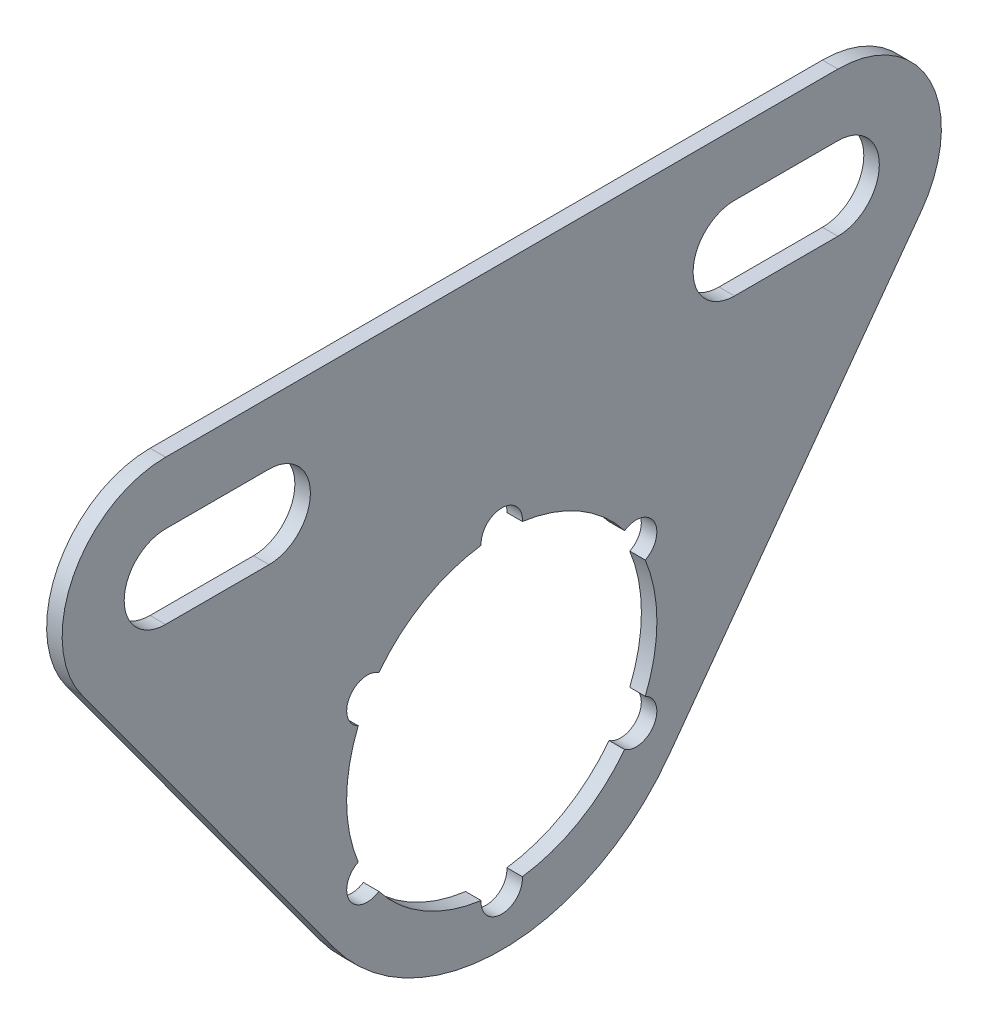
from build123d import *

# Parameters (mm, degrees)
BOSS_EXTRUDE2_DEPTH = 3


with BuildPart() as part:
    # Sketch1 → Boss-Extrude2 (new body)
    with BuildSketch(Plane(origin=(0, 0, 0), x_dir=(0, 0, -1), z_dir=(1, 0, 0))):
        with BuildLine():
            Line((65, 75), (-65, 75))
            ThreePointArc((-65, 75), (-82.834261673, 64.052022459), (-81.143613719, 43.193911059))
            Line((-81.143613719, 43.193911059), (-32.287227439, -23.612177882))
            ThreePointArc((-32.287227439, -23.612177882), (0, -40), (32.287227439, -23.612177882))
            Line((32.287227439, -23.612177882), (81.143613719, 43.193911059))
            ThreePointArc((81.143613719, 43.193911059), (82.834261673, 64.052022459), (65, 75))
        make_face()
        with BuildLine():
            ThreePointArc((-27.745372612, -11.410271628), (-30, 0), (-27.745372612, 11.410271628))
            ThreePointArc((-27.745372612, 11.410271628), (-29.444863729, 17), (-23.7542714, 18.323061706))
            ThreePointArc((-23.7542714, 18.323061706), (-15, 25.980762114), (-3.991101213, 29.733333333))
            ThreePointArc((-3.991101213, 29.733333333), (-0.133407552, 33.997774684), (4, 30))
            ThreePointArc((4, 30), (3.997774684, 29.866592448), (3.991101213, 29.733333333))
            ThreePointArc((3.991101213, 29.733333333), (15, 25.980762114), (23.7542714, 18.323061706))
            ThreePointArc((23.7542714, 18.323061706), (27.864115127, 18.528878211), (29.980762114, 15))
            ThreePointArc((29.980762114, 15), (29.376232773, 12.885578329), (27.745372612, 11.410271628))
            ThreePointArc((27.745372612, 11.410271628), (30, 0), (27.745372612, -11.410271628))
            ThreePointArc((27.745372612, -11.410271628), (29.376232773, -12.885578329), (29.980762114, -15))
            ThreePointArc((29.980762114, -15), (27.864115127, -18.528878211), (23.7542714, -18.323061706))
            ThreePointArc((23.7542714, -18.323061706), (15, -25.980762114), (3.991101213, -29.733333333))
            ThreePointArc((3.991101213, -29.733333333), (3.997774684, -29.866592448), (4, -30))
            ThreePointArc((4, -30), (-0.133407552, -33.997774684), (-3.991101213, -29.733333333))
            ThreePointArc((-3.991101213, -29.733333333), (-15, -25.980762114), (-23.7542714, -18.323061706))
            ThreePointArc((-23.7542714, -18.323061706), (-29.444863729, -17), (-27.745372612, -11.410271628))
        make_face(mode=Mode.SUBTRACT)
        with BuildLine():
            ThreePointArc((-65, 47), (-73, 55), (-65, 63))
            Line((-65, 63), (-45, 63))
            ThreePointArc((-45, 63), (-37, 55), (-45, 47))
            Line((-45, 47), (-65, 47))
        make_face(mode=Mode.SUBTRACT)
        with BuildLine():
            ThreePointArc((65, 63), (73, 55), (65, 47))
            Line((65, 47), (45, 47))
            ThreePointArc((45, 47), (37, 55), (45, 63))
            Line((45, 63), (65, 63))
        make_face(mode=Mode.SUBTRACT)
    extrude(amount=BOSS_EXTRUDE2_DEPTH)


solid = part.part
